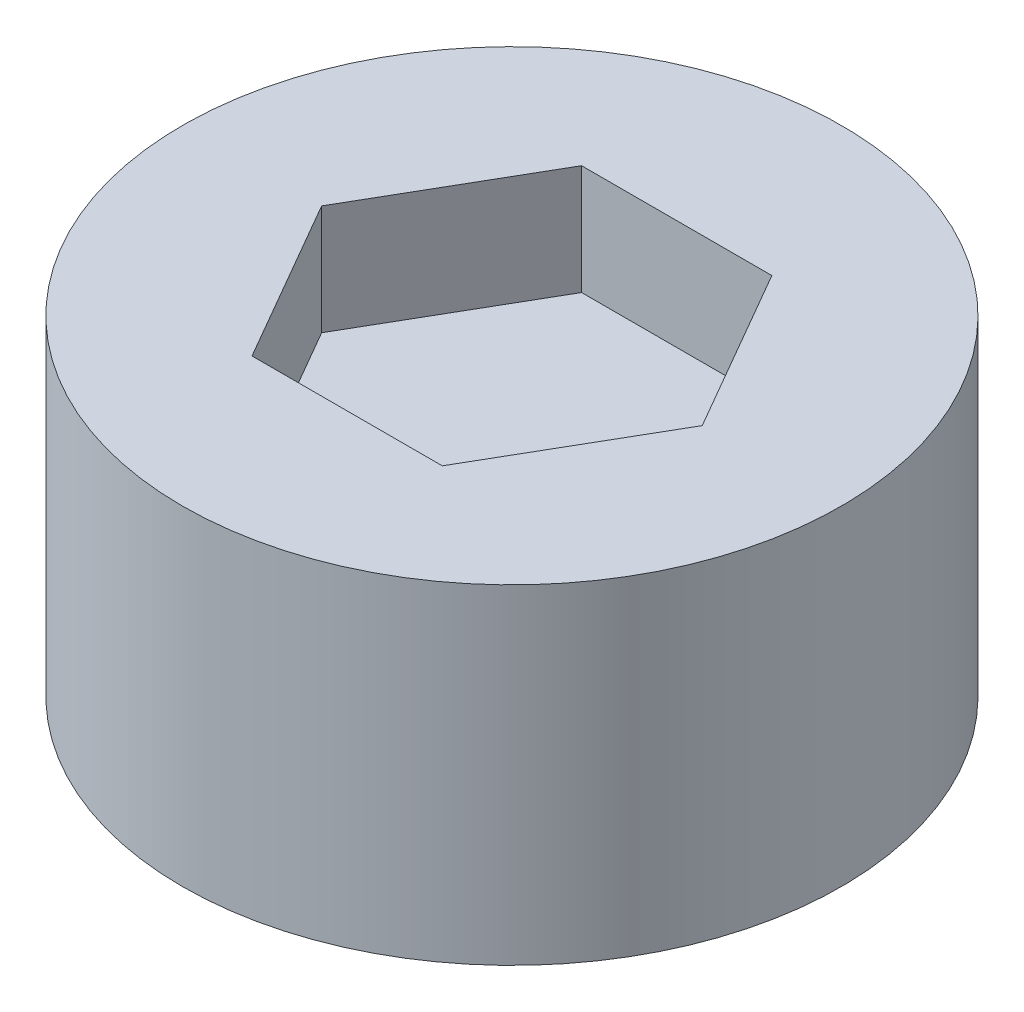
from build123d import *

# Parameters (mm, degrees)
SKETCH_1_R          = 1.5
EXTRUDE_1_DEPTH     = 1.5
CUT_EXTRUDE_1_DEPTH = 0.5


with BuildPart() as part:
    # 草图1 → 凸台-拉伸1 (new body)
    with BuildSketch(Plane(origin=(0, 0, 0), x_dir=(1, 0, 0), z_dir=(0, 1, 0))):
        with Locations(Location((0, 0, 0), (0, 0, 270))):
            Circle(SKETCH_1_R)
    extrude(amount=-EXTRUDE_1_DEPTH)

    # 草图2 → 切除-拉伸1 (cut)
    with BuildSketch(Plane(origin=(0, 0, 0), x_dir=(1, 0, 0), z_dir=(0, 1, 0))):
        Polygon((0.433012702, -0.75), (0.866025404, 0), (0.433012702, 0.75), (-0.433012702, 0.75), (-0.866025404, 0), (-0.433012702, -0.75), align=None)
    extrude(amount=-CUT_EXTRUDE_1_DEPTH, mode=Mode.SUBTRACT)


solid = part.part
